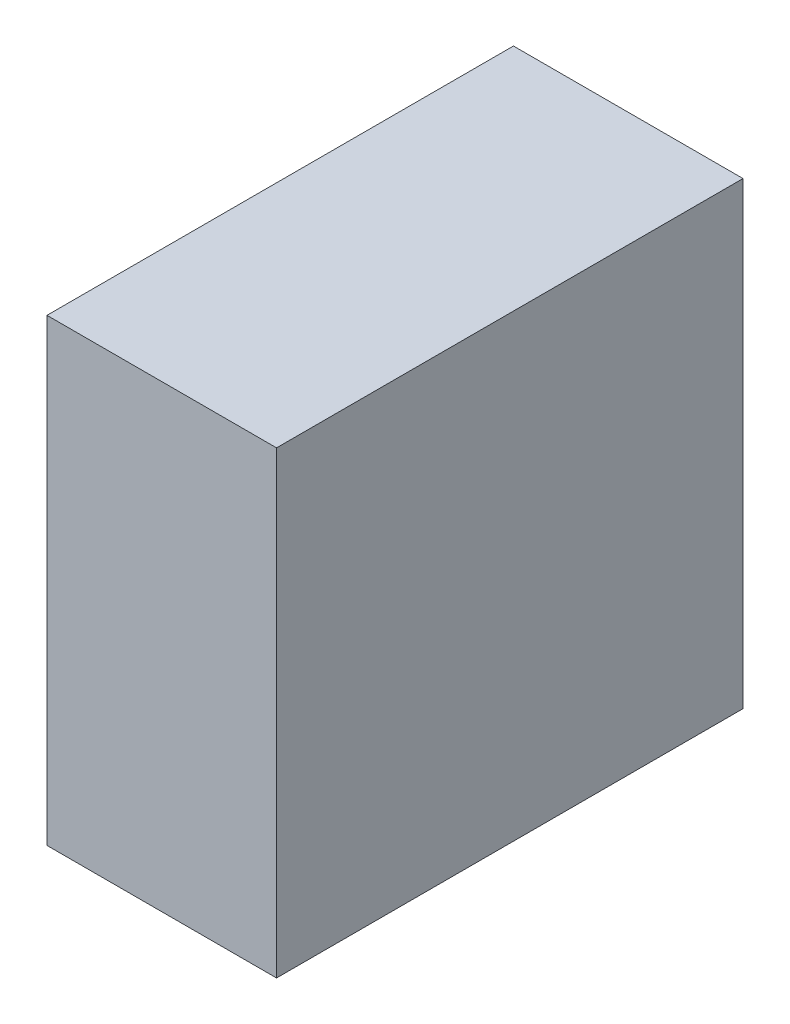
from build123d import *

# Parameters (mm, degrees)
SKETCH3_W           = 100
SKETCH3_H           = 200
BOSS_EXTRUDE1_DEPTH = 203.2


with BuildPart() as part:
    # Sketch3 → Boss-Extrude1 (new body)
    with BuildSketch(Plane.XY):
        with Locations((-50, 0)):
            Rectangle(SKETCH3_W, SKETCH3_H)
    extrude(amount=BOSS_EXTRUDE1_DEPTH)


solid = part.part
